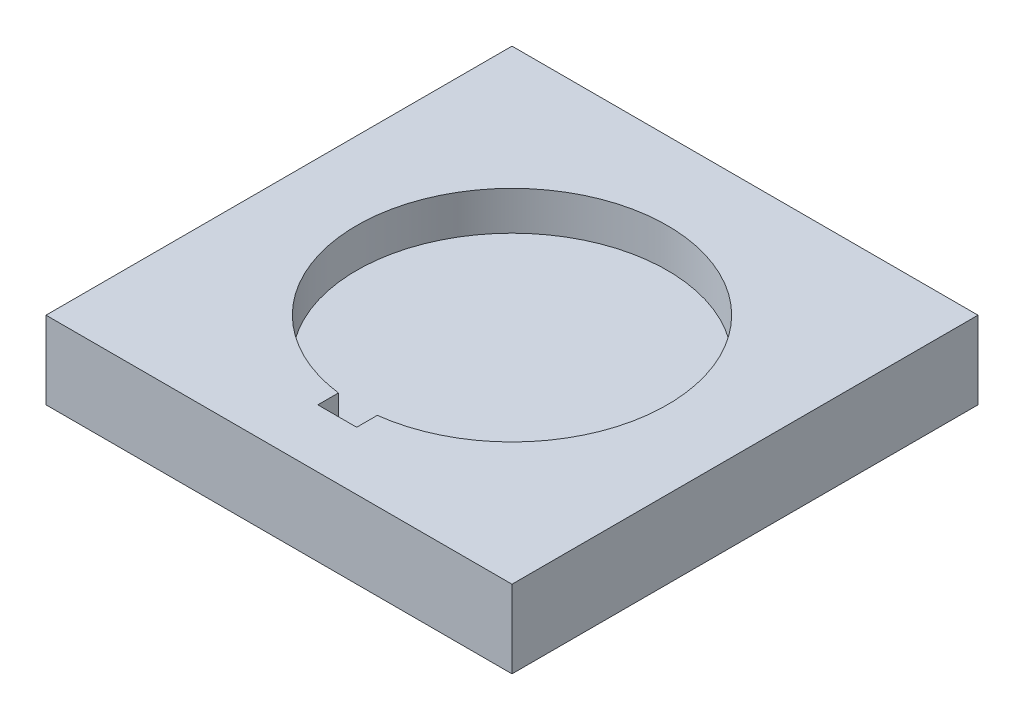
from build123d import *

# Parameters (mm, degrees)
SKETCH1_W           = 152.4
SKETCH1_H           = 152.4
BOSS_EXTRUDE1_DEPTH = 25.4
CUT_EXTRUDE1_DEPTH  = 12.7


with BuildPart() as part:
    # Sketch1 → Boss-Extrude1 (new body)
    with BuildSketch(Plane(origin=(0, 0, 0), x_dir=(1, 0, 0), z_dir=(0, 1, 0))):
        Rectangle(SKETCH1_W, SKETCH1_H)
    extrude(amount=-BOSS_EXTRUDE1_DEPTH)

    # Sketch2 → Cut-Extrude1 (cut)
    with BuildSketch(Plane(origin=(0, 0, 0), x_dir=(1, 0, 0), z_dir=(0, 1, 0))):
        with BuildLine():
            Line((-6.35, -50.401562476), (-6.35, -57.15))
            Line((-6.35, -57.15), (6.35, -57.15))
            Line((6.35, -57.15), (6.35, -50.401562476))
            ThreePointArc((6.35, -50.401562476), (0, 50.8), (-6.35, -50.401562476))
        make_face()
    extrude(amount=-CUT_EXTRUDE1_DEPTH, mode=Mode.SUBTRACT)


solid = part.part
